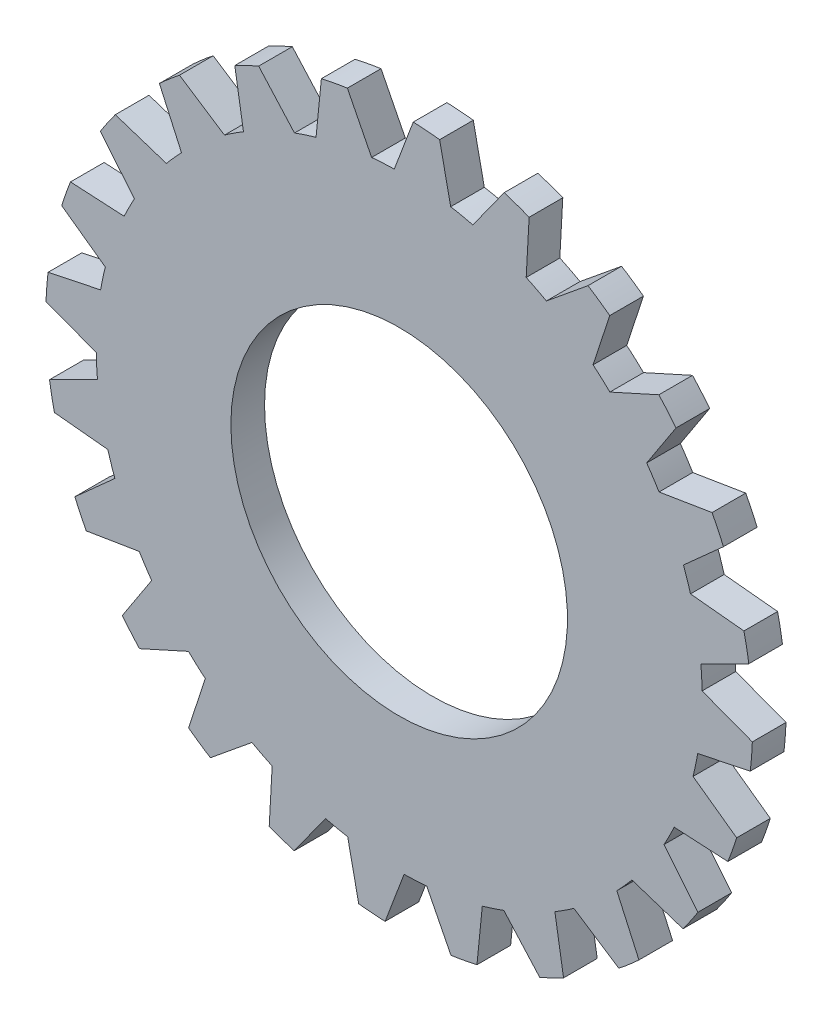
from build123d import *

# Parameters (mm, degrees)
EXTRUDE_1_DEPTH     = 200
SKETCH_2_R          = 1000
CUT_EXTRUDE_1_DEPTH = 2975.224241243


with BuildPart() as part:
    # 草图1 → 凸台-拉伸1 (new body)
    with BuildSketch(Plane.XY):
        with BuildLine():
            Line((-462.302006573, 2048.481597359), (-493.956815672, 1730.89764696))
            ThreePointArc((-493.956815672, 1730.89764696), (-558.331724226, 1711.217603265), (-621.925755378, 1689.144267017))
            Line((-621.925755378, 1689.144267017), (-834.934829889, 1926.884487933))
            ThreePointArc((-834.934829889, 1926.884487933), (-906.470322883, 1894.283915819), (-976.735498633, 1859.028715677))
            Line((-976.735498633, 1859.028715677), (-925.114921486, 1544.073308507))
            ThreePointArc((-925.114921486, 1544.073308507), (-982.202738106, 1508.402393679), (-1037.916855383, 1470.621841709))
            Line((-1037.916855383, 1470.621841709), (-1305.199518648, 1645.130455776))
            ThreePointArc((-1305.199518648, 1645.130455776), (-1365.859849883, 1595.125973231), (-1424.606080592, 1542.886099211))
            Line((-1424.606080592, 1542.886099211), (-1293.227974224, 1252.022925782))
            ThreePointArc((-1293.227974224, 1252.022925782), (-1339.138258551, 1202.792053717), (-1383.175636934, 1151.878968205))
            Line((-1383.175636934, 1151.878968205), (-1686.517017155, 1251.263501764))
            ThreePointArc((-1686.517017155, 1251.263501764), (-1732.168285303, 1187.262831638), (-1775.392112432, 1121.598344825))
            Line((-1775.392112432, 1121.598344825), (-1573.20967768, 874.64924973))
            ThreePointArc((-1573.20967768, 874.64924973), (-1604.813719706, 815.213423002), (-1634.173284633, 754.637446588))
            Line((-1634.173284633, 754.637446588), (-1952.901168044, 772.125007918))
            ThreePointArc((-1952.901168044, 772.125007918), (-1980.432314624, 698.489690113), (-2005.188105784, 623.875516767))
            Line((-2005.188105784, 623.875516767), (-1745.979741454, 437.669672735))
            ThreePointArc((-1745.979741454, 437.669672735), (-1761.123777943, 372.079344714), (-1773.804723583, 305.968630084))
            Line((-1773.804723583, 305.968630084), (-2086.198331653, 240.367470778))
            ThreePointArc((-2086.198331653, 240.367470778), (-2093.733154521, 162.115630516), (-2098.333843457, 83.636603245))
            Line((-2098.333843457, 83.636603245), (-1799.764171216, -29.136369173))
            ThreePointArc((-1799.764171216, -29.136369173), (-1797.416161108, -96.411326027), (-1792.554301972, -163.551442924))
            Line((-1792.554301972, -163.551442924), (-2077.324526565, -307.770712268))
            ThreePointArc((-2077.324526565, -307.770712268), (-2064.349539996, -385.306341392), (-2048.481597359, -462.302006573))
            Line((-2048.481597359, -462.302006573), (-1730.89764696, -493.956815672))
            ThreePointArc((-1730.89764696, -493.956815672), (-1711.217603265, -558.331724226), (-1689.144267017, -621.925755378))
            Line((-1689.144267017, -621.925755378), (-1926.884487933, -834.934829889))
            ThreePointArc((-1926.884487933, -834.934829889), (-1894.283915819, -906.470322883), (-1859.028715677, -976.735498633))
            Line((-1859.028715677, -976.735498633), (-1544.073308507, -925.114921486))
            ThreePointArc((-1544.073308507, -925.114921486), (-1508.402393679, -982.202738106), (-1470.621841709, -1037.916855383))
            Line((-1470.621841709, -1037.916855383), (-1645.130455776, -1305.199518648))
            ThreePointArc((-1645.130455776, -1305.199518648), (-1595.125973231, -1365.859849883), (-1542.886099211, -1424.606080592))
            Line((-1542.886099211, -1424.606080592), (-1252.022925782, -1293.227974224))
            ThreePointArc((-1252.022925782, -1293.227974224), (-1202.792053717, -1339.138258551), (-1151.878968205, -1383.175636934))
            Line((-1151.878968205, -1383.175636934), (-1251.263501764, -1686.517017155))
            ThreePointArc((-1251.263501764, -1686.517017155), (-1187.262831638, -1732.168285303), (-1121.598344825, -1775.392112432))
            Line((-1121.598344825, -1775.392112432), (-874.64924973, -1573.20967768))
            ThreePointArc((-874.64924973, -1573.20967768), (-815.213423002, -1604.813719706), (-754.637446588, -1634.173284633))
            Line((-754.637446588, -1634.173284633), (-772.125007918, -1952.901168044))
            ThreePointArc((-772.125007918, -1952.901168044), (-698.489690113, -1980.432314624), (-623.875516767, -2005.188105784))
            Line((-623.875516767, -2005.188105784), (-437.669672735, -1745.979741454))
            ThreePointArc((-437.669672735, -1745.979741454), (-372.079344714, -1761.123777943), (-305.968630084, -1773.804723583))
            Line((-305.968630084, -1773.804723583), (-240.367470778, -2086.198331653))
            ThreePointArc((-240.367470778, -2086.198331653), (-162.115630516, -2093.733154521), (-83.636603245, -2098.333843457))
            Line((-83.636603245, -2098.333843457), (29.136369173, -1799.764171216))
            ThreePointArc((29.136369173, -1799.764171216), (96.411326027, -1797.416161108), (163.551442924, -1792.554301972))
            Line((163.551442924, -1792.554301972), (307.770712268, -2077.324526565))
            ThreePointArc((307.770712268, -2077.324526565), (385.306341392, -2064.349539996), (462.302006573, -2048.481597359))
            Line((462.302006573, -2048.481597359), (493.956815672, -1730.89764696))
            ThreePointArc((493.956815672, -1730.89764696), (558.331724226, -1711.217603265), (621.925755378, -1689.144267017))
            Line((621.925755378, -1689.144267017), (834.934829889, -1926.884487933))
            ThreePointArc((834.934829889, -1926.884487933), (906.470322883, -1894.283915819), (976.735498633, -1859.028715677))
            Line((976.735498633, -1859.028715677), (925.114921486, -1544.073308507))
            ThreePointArc((925.114921486, -1544.073308507), (982.202738106, -1508.402393679), (1037.916855383, -1470.621841709))
            Line((1037.916855383, -1470.621841709), (1305.199518648, -1645.130455776))
            ThreePointArc((1305.199518648, -1645.130455776), (1365.859849883, -1595.125973231), (1424.606080592, -1542.886099211))
            Line((1424.606080592, -1542.886099211), (1293.227974224, -1252.022925782))
            ThreePointArc((1293.227974224, -1252.022925782), (1339.138258551, -1202.792053717), (1383.175636934, -1151.878968205))
            Line((1383.175636934, -1151.878968205), (1686.517017155, -1251.263501764))
            ThreePointArc((1686.517017155, -1251.263501764), (1732.168285303, -1187.262831638), (1775.392112432, -1121.598344825))
            Line((1775.392112432, -1121.598344825), (1573.20967768, -874.64924973))
            ThreePointArc((1573.20967768, -874.64924973), (1604.813719706, -815.213423002), (1634.173284633, -754.637446588))
            Line((1634.173284633, -754.637446588), (1952.901168044, -772.125007918))
            ThreePointArc((1952.901168044, -772.125007918), (1980.432314624, -698.489690113), (2005.188105784, -623.875516767))
            Line((2005.188105784, -623.875516767), (1745.979741454, -437.669672735))
            ThreePointArc((1745.979741454, -437.669672735), (1761.123777943, -372.079344714), (1773.804723583, -305.968630084))
            Line((1773.804723583, -305.968630084), (2086.198331653, -240.367470778))
            ThreePointArc((2086.198331653, -240.367470778), (2093.733154521, -162.115630516), (2098.333843457, -83.636603245))
            Line((2098.333843457, -83.636603245), (1799.764171216, 29.136369173))
            ThreePointArc((1799.764171216, 29.136369173), (1797.416161108, 96.411326027), (1792.554301972, 163.551442924))
            Line((1792.554301972, 163.551442924), (2077.324526565, 307.770712268))
            ThreePointArc((2077.324526565, 307.770712268), (2064.349539996, 385.306341392), (2048.481597359, 462.302006573))
            Line((2048.481597359, 462.302006573), (1730.89764696, 493.956815672))
            ThreePointArc((1730.89764696, 493.956815672), (1711.217603265, 558.331724226), (1689.144267017, 621.925755378))
            Line((1689.144267017, 621.925755378), (1926.884487933, 834.934829889))
            ThreePointArc((1926.884487933, 834.934829889), (1894.283915819, 906.470322883), (1859.028715677, 976.735498633))
            Line((1859.028715677, 976.735498633), (1544.073308507, 925.114921486))
            ThreePointArc((1544.073308507, 925.114921486), (1508.402393679, 982.202738106), (1470.621841709, 1037.916855383))
            Line((1470.621841709, 1037.916855383), (1645.130455776, 1305.199518648))
            ThreePointArc((1645.130455776, 1305.199518648), (1595.125973231, 1365.859849883), (1542.886099211, 1424.606080592))
            Line((1542.886099211, 1424.606080592), (1252.022925782, 1293.227974224))
            ThreePointArc((1252.022925782, 1293.227974224), (1202.792053717, 1339.138258551), (1151.878968205, 1383.175636934))
            Line((1151.878968205, 1383.175636934), (1251.263501764, 1686.517017155))
            ThreePointArc((1251.263501764, 1686.517017155), (1187.262831638, 1732.168285303), (1121.598344825, 1775.392112432))
            Line((1121.598344825, 1775.392112432), (874.64924973, 1573.20967768))
            ThreePointArc((874.64924973, 1573.20967768), (815.213423002, 1604.813719706), (754.637446588, 1634.173284633))
            Line((754.637446588, 1634.173284633), (772.125007918, 1952.901168044))
            ThreePointArc((772.125007918, 1952.901168044), (698.489690113, 1980.432314624), (623.875516767, 2005.188105784))
            Line((623.875516767, 2005.188105784), (437.669672735, 1745.979741454))
            ThreePointArc((437.669672735, 1745.979741454), (372.079344714, 1761.123777943), (305.968630084, 1773.804723583))
            Line((305.968630084, 1773.804723583), (240.367470778, 2086.198331653))
            ThreePointArc((240.367470778, 2086.198331653), (162.115630516, 2093.733154521), (83.636603245, 2098.333843457))
            Line((83.636603245, 2098.333843457), (-29.136369173, 1799.764171216))
            ThreePointArc((-29.136369173, 1799.764171216), (-96.411326027, 1797.416161108), (-163.551442924, 1792.554301972))
            Line((-163.551442924, 1792.554301972), (-307.770712268, 2077.324526565))
            ThreePointArc((-307.770712268, 2077.324526565), (-385.306341392, 2064.349539996), (-462.302006573, 2048.481597359))
        make_face()
    extrude(amount=EXTRUDE_1_DEPTH)

    # 草图2 → 切除-拉伸1 (cut, through all)
    with BuildSketch(Plane(origin=(0, 0, 0), x_dir=(-1, 0, 0), z_dir=(0, 0, -1))):
        Circle(SKETCH_2_R)
    extrude(amount=-CUT_EXTRUDE_1_DEPTH, mode=Mode.SUBTRACT)


solid = part.part
